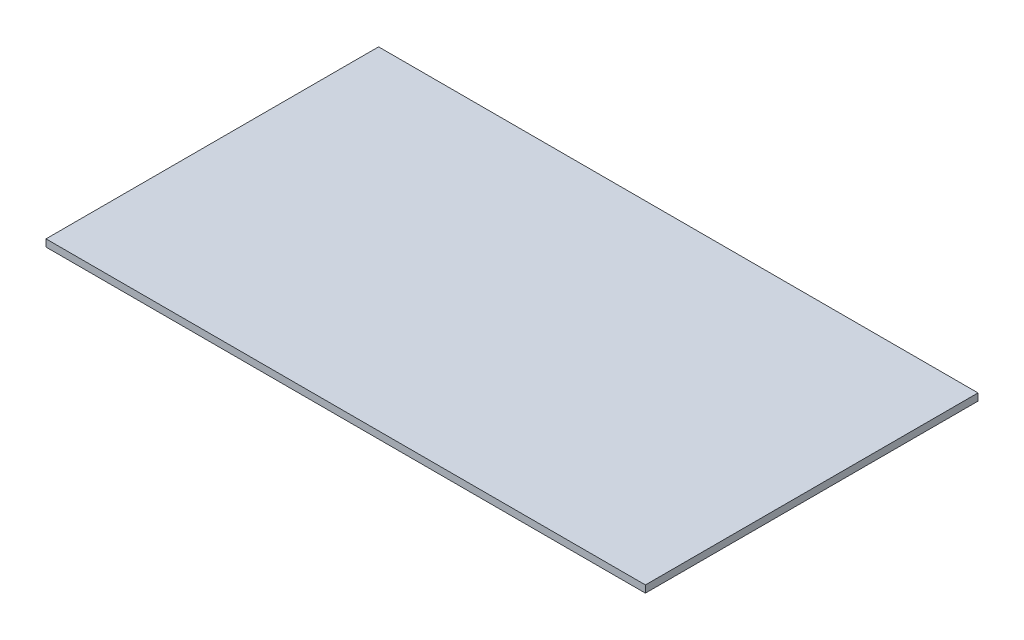
from build123d import *

# Parameters (mm, degrees)
SKETCH2_W           = 12.58
SKETCH2_H           = 6.98
BOSS_EXTRUDE2_DEPTH = 0.075


with BuildPart() as part:
    # Sketch2 → Boss-Extrude2 (new, symmetric)
    with BuildSketch(Plane(origin=(0, 0, 0), x_dir=(1, 0, 0), z_dir=(0, 1, 0))):
        Rectangle(SKETCH2_W, SKETCH2_H)
    extrude(amount=BOSS_EXTRUDE2_DEPTH, both=True)


solid = part.part
